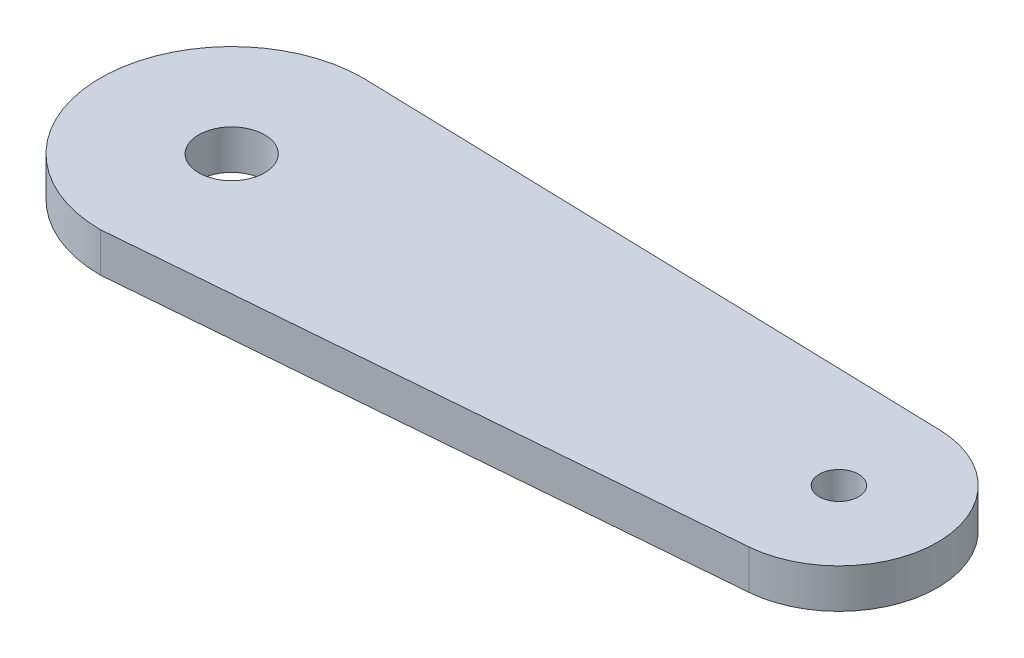
from build123d import *

# Parameters (mm, degrees)
BOSS_EXTRUDE1_DEPTH = 3
CUT_EXTRUDE1_REACH  = 55.511
SKETCH2_R           = 2.51
SKETCH2_R_2         = 1.495


with BuildPart() as part:
    # Sketch1 → Boss-Extrude1 (new body)
    with BuildSketch(Plane(origin=(0, 0, 0), x_dir=(1, 0, 0), z_dir=(0, 1, 0))):
        with BuildLine():
            ThreePointArc((0, 10), (-10, 0), (0, -10))
            Line((0, -10), (45.601011206, -6.227938292))
            ThreePointArc((45.601011206, -6.227938292), (52.479923025, 1.451771759), (45.191159304, 8.743636932))
            Line((45.191159304, 8.743636932), (0, 10))
        make_face()
    extrude(amount=BOSS_EXTRUDE1_DEPTH)

    # Sketch2 → Cut-Extrude1 (cut, up to next)
    with BuildSketch(Plane(origin=(0, 3, 0), x_dir=(1, 0, 0), z_dir=(0, 1, 0)), mode=Mode.PRIVATE) as cut_extrude1_sk1:
        with Locations(Location((0, 0, 0), (0, 0, 270))):
            Circle(SKETCH2_R)
    cut_extrude1_tool1 = extrude(cut_extrude1_sk1.sketch, amount=-CUT_EXTRUDE1_REACH, mode=Mode.PRIVATE) & part.part
    # Sketch2 → Cut-Extrude1 (cut, up to next)
    with BuildSketch(Plane(origin=(0, 3, 0), x_dir=(1, 0, 0), z_dir=(0, 1, 0)), mode=Mode.PRIVATE) as cut_extrude1_sk2:
        with Locations(Location((44.98273173, 1.246533628, 0), (0, 0, 270))):
            Circle(SKETCH2_R_2)
    cut_extrude1_tool2 = extrude(cut_extrude1_sk2.sketch, amount=-CUT_EXTRUDE1_REACH, mode=Mode.PRIVATE) & part.part
    add(cut_extrude1_tool1.solids().sort_by_distance((0, 3, 0))[0], mode=Mode.SUBTRACT)
    add(cut_extrude1_tool2.solids().sort_by_distance((44.982732, 3, -1.246534))[0], mode=Mode.SUBTRACT)


solid = part.part
